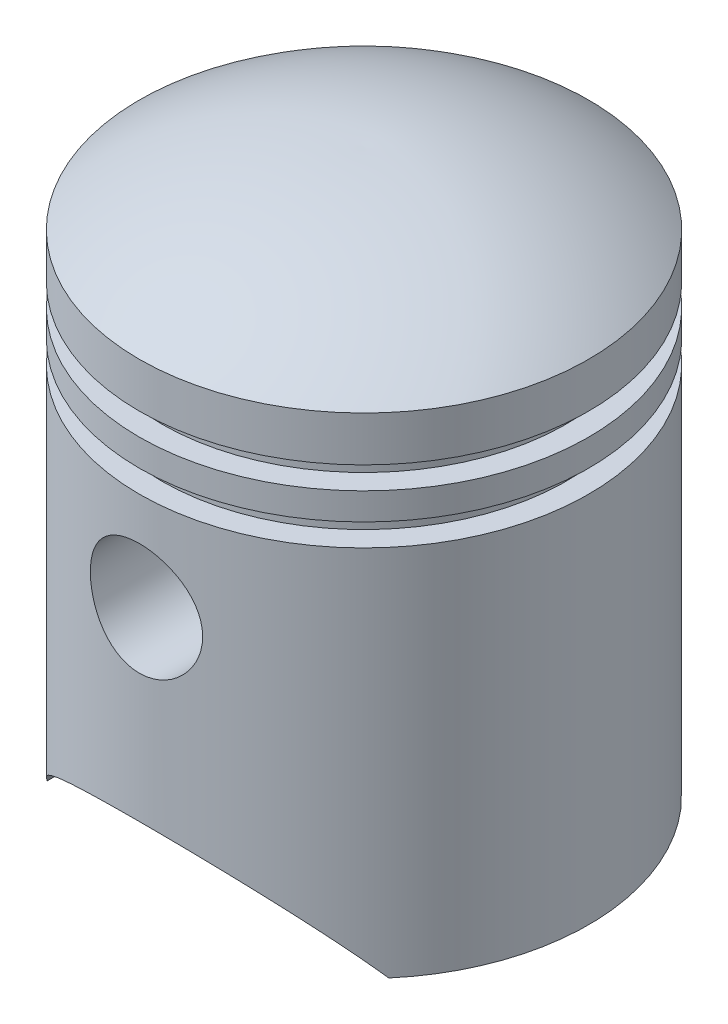
from build123d import *

# Parameters (mm, degrees)
CUT_EXTRUDE1_DEPTH       = 70
SKETCH3_R                = 6.25
CUT_EXTRUDE2_DEPTH       = 70
BOSS_EXTRUDE2_REACH      = 78.823
BOSS_EXTRUDE2_END_RADIUS = 23
SKETCH4_R                = 7.25
SKETCH4_R_2              = 6.25


with BuildPart() as part:
    # Sketch1 → Revolve1 (revolve)
    with BuildSketch(Plane.XY, mode=Mode.PRIVATE) as revolve1_sk:
        with BuildLine():
            Line((0, 62.5), (0, 60.49936285))
            ThreePointArc((0, 60.49936285), (12.069492637, 58.859165445), (23, 53.484511145))
            Line((23, 53.484511145), (23, 51.5))
            Line((23, 51.5), (20.5, 51.5))
            Line((20.5, 51.5), (20.5, 45.5))
            Line((20.5, 45.5), (20.5, 39.5))
            Line((20.5, 39.5), (23, 39.5))
            Line((23, 39.5), (23, 0))
            Line((23, 0), (25, 0))
            Line((25, 0), (25, 41.5))
            Line((25, 41.5), (22.5, 41.5))
            Line((22.5, 41.5), (22.5, 44))
            Line((22.5, 44), (25, 44))
            Line((25, 44), (25, 47))
            Line((25, 47), (22.5, 47))
            Line((22.5, 47), (22.5, 49.5))
            Line((22.5, 49.5), (25, 49.5))
            Line((25, 49.5), (25, 54.5))
            ThreePointArc((25, 54.5), (13.174901691, 60.609067785), (0, 62.5))
        make_face()
    revolve(revolve1_sk.sketch.rotate(Axis((0, 62.5, 0), (0, -1, 0)), 90), axis=Axis((0, 62.5, 0), (0, -1, 0)))

    # Sketch2 → Cut-Extrude1 (cut, symmetric)
    with BuildSketch(Plane.XY):
        with BuildLine():
            Line((-19, 0), (19, 0))
            ThreePointArc((19, 0), (0, 9.949493307), (-19, 0))
        make_face()
    extrude(amount=CUT_EXTRUDE1_DEPTH, both=True, mode=Mode.SUBTRACT)

    # Sketch3 → Cut-Extrude2 (cut, symmetric)
    with BuildSketch(Plane.XY):
        with Locations((0, 30.5)):
            Circle(SKETCH3_R)
    extrude(amount=CUT_EXTRUDE2_DEPTH, both=True, mode=Mode.SUBTRACT)

    # Boss-Extrude2: up to this cylinder (the profile starts inside it)
    boss_extrude2_end = Plane(origin=(0, 23.455061, 0), z_dir=(0, 1, 0)) * Cylinder(BOSS_EXTRUDE2_END_RADIUS, 204.646, mode=Mode.PRIVATE)
    # Sketch4 → Boss-Extrude2 (add, up to the surface)
    with BuildSketch(Plane.XY.offset(12), mode=Mode.PRIVATE) as boss_extrude2_sk1:
        with Locations(Location((0, 30.5, 0), (0, 0, 90))):
            Circle(SKETCH4_R)
        with Locations((0, 30.5)):
            Circle(SKETCH4_R_2, mode=Mode.SUBTRACT)
    boss_extrude2_tool1 = extrude(boss_extrude2_sk1.sketch, amount=BOSS_EXTRUDE2_REACH, mode=Mode.PRIVATE) & boss_extrude2_end
    boss_extrude2 = boss_extrude2_tool1.solids().sort_by_distance((0, 23.455061, 12))[0]
    add(boss_extrude2)

    # Mirror1: Boss-Extrude2 across plane
    add(boss_extrude2.mirror(Plane.XY))


solid = part.part
